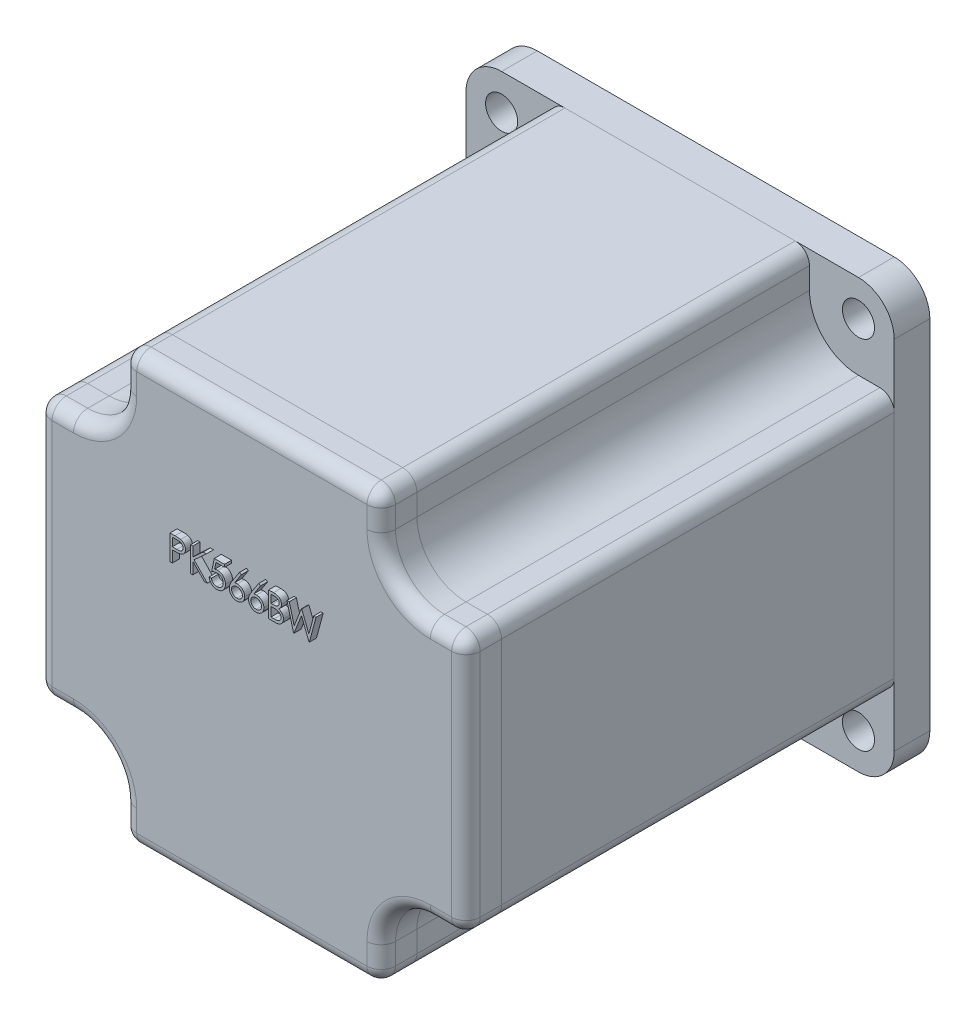
from build123d import *

# Parameters (mm, degrees)
SKETCH1_R           = 2.25
BOSS_EXTRUDE1_DEPTH = 5
BOSS_EXTRUDE2_DEPTH = 60
FILLET1_R           = 2
SKETCH3_R           = 18
BOSS_EXTRUDE3_DEPTH = 1.5
BOSS_EXTRUDE4_DEPTH = 23
BOSS_EXTRUDE5_DEPTH = 1


with BuildPart() as part:
    # Sketch1 → Boss-Extrude1 (new body)
    with BuildSketch(Plane.XY):
        with BuildLine():
            Line((-25, 30), (25, 30))
            ThreePointArc((25, 30), (28.535533906, 28.535533906), (30, 25))
            Line((30, 25), (30, -25))
            ThreePointArc((30, -25), (28.535533906, -28.535533906), (25, -30))
            Line((25, -30), (-25, -30))
            ThreePointArc((-25, -30), (-28.535533906, -28.535533906), (-30, -25))
            Line((-30, -25), (-30, 25))
            ThreePointArc((-30, 25), (-28.535533906, 28.535533906), (-25, 30))
        make_face()
        with Locations((-25, 25)):
            Circle(SKETCH1_R, mode=Mode.SUBTRACT)
        with Locations((25, 25)):
            Circle(SKETCH1_R, mode=Mode.SUBTRACT)
        with Locations((25, -25)):
            Circle(SKETCH1_R, mode=Mode.SUBTRACT)
        with Locations((-25, -25)):
            Circle(SKETCH1_R, mode=Mode.SUBTRACT)
    extrude(amount=-BOSS_EXTRUDE1_DEPTH)

    # Sketch2 → Boss-Extrude2 (add)
    with BuildSketch(Plane.XY):
        with BuildLine():
            Line((-18.130205111, 25), (-18.130205111, 30))
            Line((-18.130205111, 30), (18.130205111, 30))
            Line((18.130205111, 30), (18.130205111, 25))
            ThreePointArc((18.130205111, 25), (20.142321448, 20.142321448), (25, 18.130205111))
            Line((25, 18.130205111), (30, 18.130205111))
            Line((30, 18.130205111), (30, -18.130205111))
            Line((30, -18.130205111), (25, -18.130205111))
            ThreePointArc((25, -18.130205111), (20.142321448, -20.142321448), (18.130205111, -25))
            Line((18.130205111, -25), (18.130205111, -30))
            Line((18.130205111, -30), (-18.130205111, -30))
            Line((-18.130205111, -30), (-18.130205111, -25))
            ThreePointArc((-18.130205111, -25), (-20.142321448, -20.142321448), (-25, -18.130205111))
            Line((-25, -18.130205111), (-30, -18.130205111))
            Line((-30, -18.130205111), (-30, 18.130205111))
            Line((-30, 18.130205111), (-25, 18.130205111))
            ThreePointArc((-25, 18.130205111), (-20.142321448, 20.142321448), (-18.130205111, 25))
        make_face()
    extrude(amount=BOSS_EXTRUDE2_DEPTH)

    # Fillet1
    fillet1_edges = [part.edges().sort_by_distance(p)[0] for p in [
        (18.130205111, -27.5, 60),
        (27.5, -18.130205111, 60),
        (27.5, 18.130205111, 60),
        (18.130205111, 27.5, 60),
        (-18.130205111, 27.5, 60),
        (-27.5, 18.130205111, 60),
        (18.130205111, 30, 30),
        (30, 18.130205111, 30),
        (0, -30, 60),
        (20.142321448, -20.142321448, 60),
        (30, 0, 60),
        (20.142321448, 20.142321448, 60),
        (0, 30, 60),
        (-20.142321448, 20.142321448, 60),
        (-30, 0, 60),
        (30, -18.130205111, 30),
        (18.130205111, -30, 30),
        (-18.130205111, -30, 30),
        (-30, -18.130205111, 30),
        (-30, 18.130205111, 30),
        (-18.130205111, 30, 30),
        (-27.5, -18.130205111, 60),
        (-18.130205111, -27.5, 60),
        (-20.142321448, -20.142321448, 60),
    ]]
    fillet(fillet1_edges, radius=FILLET1_R)

    # Sketch3 → Boss-Extrude3 (add)
    with BuildSketch(Plane(origin=(0, 0, -5), x_dir=(-1, 0, 0), z_dir=(0, 0, -1))):
        Circle(SKETCH3_R)
    extrude(amount=BOSS_EXTRUDE3_DEPTH)

    # Sketch4 → Boss-Extrude4 (add)
    with BuildSketch(Plane(origin=(0, 0, -6.5), x_dir=(-1, 0, 0), z_dir=(0, 0, -1))):
        with BuildLine():
            Line((-1.936491673, 3.5), (1.936491673, 3.5))
            ThreePointArc((1.936491673, 3.5), (0, -4), (-1.936491673, 3.5))
        make_face()
    extrude(amount=BOSS_EXTRUDE4_DEPTH)

    # Sketch5 → Boss-Extrude5 (add)
    # profile 1 of 7: a face of its own
    with BuildSketch(Plane.XY.offset(60)):
        with BuildLine():
            Line((-10.46341446, 11.772716187), (-9.777016222, 11.772716187))
            add(Edge.make_bspline(
                [(-9.777016222, 11.772716187), (-9.729805316, 11.772664291), (-9.639347123, 11.772564855), (-9.509632068, 11.769550109), (-9.391822336, 11.765523417), (-9.286171955, 11.759941524), (-9.192355857, 11.753344934), (-9.110798558, 11.744092894), (-9.040859001, 11.734432599), (-8.998952552, 11.724611192), (-8.979840742, 11.720132052)],
                knots=[0, 0, 0, 0, 1.415646017, 2.712440637, 3.8905458, 4.950247383, 5.884950622, 6.709939814, 7.411656543, 8, 8, 8, 8], degree=3))
            add(Edge.make_bspline(
                [(-8.979840742, 11.720132052), (-8.955647208, 11.713510102), (-8.907830231, 11.700422241), (-8.838929188, 11.674208517), (-8.773375342, 11.643126352), (-8.710943784, 11.607702412), (-8.652401701, 11.566416848), (-8.59687566, 11.52094323), (-8.544855679, 11.470231662), (-8.496634287, 11.414850922), (-8.45234949, 11.355730712), (-8.414219807, 11.291988482), (-8.38229258, 11.224697179), (-8.354909309, 11.153903607), (-8.335200854, 11.079013284), (-8.320353954, 11.000546572), (-8.310930327, 10.918511881), (-8.310027765, 10.862452014), (-8.309568306, 10.833914103)],
                knots=[0, 0, 0, 0, 0.999701418, 1.975846123, 2.934577507, 3.890451536, 4.834027766, 5.787354733, 6.749476667, 7.726910423, 8.712836071, 9.690891519, 10.682875813, 11.679750201, 12.712814741, 13.765529915, 14.8625177, 16, 16, 16, 16], degree=3))
            add(Edge.make_bspline(
                [(-8.309568306, 10.833914103), (-8.30998973, 10.805136327), (-8.310814276, 10.748830663), (-8.320710562, 10.666457875), (-8.334040753, 10.587739484), (-8.354537806, 10.512850034), (-8.381383479, 10.442234263), (-8.412875532, 10.374813031), (-8.450859062, 10.31173336), (-8.494503892, 10.252766242), (-8.543055486, 10.19785633), (-8.596308424, 10.147401535), (-8.654047717, 10.101697197), (-8.716089865, 10.060640853), (-8.783039714, 10.025184574), (-8.853881867, 9.993427269), (-8.929232084, 9.966756208), (-8.981374598, 9.952726147), (-9.007885613, 9.945592789)],
                knots=[0, 0, 0, 0, 1.121902311, 2.195077645, 3.232258892, 4.234102512, 5.217864754, 6.176164875, 7.132989551, 8.084763148, 9.034132444, 9.988522005, 10.94243251, 11.903244335, 12.886203696, 13.894208494, 14.929344452, 16, 16, 16, 16], degree=3))
            add(Edge.make_bspline(
                [(-9.007885613, 9.945592789), (-9.029812947, 9.940929808), (-9.077867975, 9.930710614), (-9.157010697, 9.919302157), (-9.249156083, 9.909564557), (-9.354178363, 9.902263419), (-9.471983268, 9.896013051), (-9.602634525, 9.891044957), (-9.746388602, 9.888315103), (-9.846659846, 9.88817431), (-9.899011415, 9.888100802)],
                knots=[0, 0, 0, 0, 0.601384939, 1.31797006, 2.144135048, 3.087295005, 4.142315834, 5.309527816, 6.595305764, 8, 8, 8, 8], degree=3))
            Line((-9.899011415, 9.888100802), (-10.149311895, 9.888100802))
            Line((-10.149311895, 9.888100802), (-10.149311895, 8.272716187))
            Line((-10.149311895, 8.272716187), (-10.46341446, 8.272716187))
            Line((-10.46341446, 8.272716187), (-10.46341446, 11.772716187))
        make_face()
        with BuildLine():
            Line((-10.149311895, 11.413741828), (-10.149311895, 10.247075161))
            Line((-10.149311895, 10.247075161), (-9.536531447, 10.239362821))
            add(Edge.make_bspline(
                [(-9.536531447, 10.239362821), (-9.506611521, 10.239347358), (-9.448851721, 10.239317506), (-9.365415498, 10.243302729), (-9.28800621, 10.247903262), (-9.216861635, 10.254639185), (-9.151949701, 10.264160443), (-9.093162172, 10.273772181), (-9.040954889, 10.287677543), (-8.979855687, 10.306400612), (-8.91177234, 10.338333228), (-8.837704791, 10.384683118), (-8.774934205, 10.443763826), (-8.720615908, 10.510191658), (-8.67751003, 10.584090787), (-8.645954038, 10.663159724), (-8.62741288, 10.746587573), (-8.624926687, 10.803675712), (-8.62367087, 10.83251186)],
                knots=[0, 0, 0, 0, 1.160613943, 2.240541288, 3.23993089, 4.169200891, 5.011653406, 5.7853311, 6.478053781, 7.106038997, 8.262395093, 9.384106736, 10.481365981, 11.59014053, 12.70357646, 13.786202915, 14.881775077, 16, 16, 16, 16], degree=3))
            add(Edge.make_bspline(
                [(-8.62367087, 10.83251186), (-8.624933516, 10.860650373), (-8.627443501, 10.916586255), (-8.646099364, 10.998565016), (-8.677448678, 11.07680072), (-8.720905273, 11.149773806), (-8.773646403, 11.21596261), (-8.834945746, 11.273459737), (-8.904659007, 11.31968144), (-8.969507238, 11.349514721), (-9.027108424, 11.367729997), (-9.077140384, 11.380474837), (-9.133631059, 11.390650443), (-9.196598838, 11.398889946), (-9.265555672, 11.405943407), (-9.341093987, 11.410729385), (-9.42292763, 11.413530841), (-9.479738201, 11.413669796), (-9.509187697, 11.413741828)],
                knots=[0, 0, 0, 0, 1.120700087, 2.227813068, 3.331159281, 4.466773991, 5.599788987, 6.693661531, 7.80175334, 8.91857717, 9.525282508, 10.207424825, 10.974604443, 11.810962634, 12.737642355, 13.736264703, 14.826523623, 16, 16, 16, 16], degree=3))
            Line((-9.509187697, 11.413741828), (-10.149311895, 11.413741828))
        make_face(mode=Mode.SUBTRACT)
    # profile 2 of 7: a face of its own
    with BuildSketch(Plane.XY.offset(60)):
        Polygon((-7.591619588, 11.772716187), (-7.277517024, 11.772716187), (-7.277517024, 10.439883655), (-5.818482569, 11.772716187), (-5.370465742, 11.772716187), (-7.090317504, 10.202203366), (-5.235850357, 8.272716187), (-5.654420069, 8.272716187), (-7.277517024, 9.961718591), (-7.277517024, 8.272716187), (-7.591619588, 8.272716187), align=None)
    # profile 3 of 7: a face of its own
    with BuildSketch(Plane.XY.offset(60)):
        with BuildLine():
            Line((-2.835209331, 11.772716187), (-2.835209331, 11.413741828))
            Line((-2.835209331, 11.413741828), (-4.025714139, 11.413741828))
            Line((-4.025714139, 11.413741828), (-4.214315902, 10.493168911))
            add(Edge.make_bspline(
                [(-4.214315902, 10.493168911), (-4.177260028, 10.503399183), (-4.105470132, 10.523218717), (-3.999510271, 10.545224487), (-3.898918067, 10.558489931), (-3.833642697, 10.560301242), (-3.802056286, 10.561177725)],
                knots=[0, 0, 0, 0, 1.100273476, 2.13160584, 3.095893838, 4, 4, 4, 4], degree=3))
            add(Edge.make_bspline(
                [(-3.802056286, 10.561177725), (-3.762972547, 10.56033179), (-3.686124149, 10.558668469), (-3.573685202, 10.542696619), (-3.466352309, 10.517556705), (-3.364349939, 10.482436183), (-3.267489388, 10.43752645), (-3.176661827, 10.381426509), (-3.090503914, 10.315893178), (-3.01056132, 10.240548166), (-2.938037012, 10.157626549), (-2.874271022, 10.068468678), (-2.820108432, 9.973941016), (-2.776547677, 9.873140407), (-2.741763343, 9.767181254), (-2.718611348, 9.654948671), (-2.703194639, 9.537500551), (-2.701472253, 9.457195981), (-2.700593947, 9.416245834)],
                knots=[0, 0, 0, 0, 1.052922333, 2.070308379, 3.05430497, 4.020497103, 4.973039431, 5.925935799, 6.892292201, 7.88610001, 8.88166317, 9.857072816, 10.836096531, 11.812156883, 12.81219415, 13.836441305, 14.89672472, 16, 16, 16, 16], degree=3))
            add(Edge.make_bspline(
                [(-2.700593947, 9.416245834), (-2.701259022, 9.387723614), (-2.702580185, 9.331064626), (-2.709298772, 9.246920426), (-2.722234488, 9.164557593), (-2.739602212, 9.083965201), (-2.76214463, 9.005295828), (-2.789433684, 8.928324301), (-2.822829712, 8.853529694), (-2.859461087, 8.780204299), (-2.900707565, 8.710005792), (-2.946486072, 8.644356805), (-2.994851564, 8.582272524), (-3.046892949, 8.524418791), (-3.103093944, 8.471175773), (-3.162773911, 8.422227491), (-3.22545663, 8.376746161), (-3.292111872, 8.336577966), (-3.361254355, 8.29961501), (-3.433882573, 8.269291472), (-3.508343273, 8.242180944), (-3.585708149, 8.220571417), (-3.665801961, 8.203638862), (-3.748756737, 8.192138261), (-3.834137407, 8.183761824), (-3.892012419, 8.183237467), (-3.921246992, 8.182972597)],
                knots=[0, 0, 0, 0, 1.056347294, 2.098418968, 3.122841568, 4.141288669, 5.149314143, 6.15115421, 7.162517403, 8.180376062, 9.185164535, 10.17417709, 11.141909838, 12.097768115, 13.052685741, 14.0056014, 14.954263652, 15.917497458, 16.885230207, 17.854509472, 18.828990115, 19.81800267, 20.826176721, 21.857883937, 22.917946725, 24, 24, 24, 24], degree=3))
            add(Edge.make_bspline(
                [(-3.921246992, 8.182972597), (-3.956121172, 8.183663435), (-4.024732003, 8.185022577), (-4.12525257, 8.199241062), (-4.221967176, 8.219604979), (-4.314097277, 8.250241249), (-4.402468541, 8.288628543), (-4.485891258, 8.337144715), (-4.566497034, 8.392123819), (-4.641009071, 8.457004172), (-4.710165185, 8.527919854), (-4.772071694, 8.604877495), (-4.82720527, 8.686606937), (-4.874683017, 8.773505091), (-4.915181039, 8.865343622), (-4.946996027, 8.962466623), (-4.972674382, 9.064366627), (-4.983537802, 9.134520137), (-4.989055485, 9.170152084)],
                knots=[0, 0, 0, 0, 1.0467383, 2.05933395, 3.04377827, 4.011590433, 4.970194871, 5.932262533, 6.905835911, 7.896367577, 8.894135286, 9.877477877, 10.858688626, 11.851381753, 12.8477658, 13.868841284, 14.917554742, 16, 16, 16, 16], degree=3))
            Line((-4.989055485, 9.170152084), (-4.674952921, 9.170152084))
            add(Edge.make_bspline(
                [(-4.674952921, 9.170152084), (-4.667224364, 9.136775632), (-4.652369647, 9.072624237), (-4.619763899, 8.982492896), (-4.579898023, 8.902173672), (-4.532493675, 8.830604089), (-4.475943644, 8.768195091), (-4.411414215, 8.712578029), (-4.339066492, 8.6624029), (-4.258673262, 8.620580133), (-4.173860183, 8.584911379), (-4.085092973, 8.561159685), (-3.994788627, 8.544458792), (-3.933710256, 8.542787031), (-3.903017825, 8.541946956)],
                knots=[0, 0, 0, 0, 1.136247022, 2.183929868, 3.172523383, 4.106158343, 5.02341133, 5.958108904, 6.928429099, 7.938127109, 8.96079061, 9.975095812, 10.982467395, 12, 12, 12, 12], degree=3))
            add(Edge.make_bspline(
                [(-3.903017825, 8.541946956), (-3.873059381, 8.542767734), (-3.814070958, 8.544383852), (-3.727259572, 8.556822864), (-3.643446697, 8.575980436), (-3.563459341, 8.604650291), (-3.485897801, 8.639495009), (-3.412724031, 8.684210085), (-3.341821154, 8.735670103), (-3.27539302, 8.794626733), (-3.214553571, 8.859596428), (-3.16079745, 8.929073821), (-3.116020536, 9.003190668), (-3.078286427, 9.080663821), (-3.049633129, 9.162342378), (-3.029192147, 9.247843553), (-3.017189088, 9.337378533), (-3.015537909, 9.398447843), (-3.014696511, 9.429567148)],
                knots=[0, 0, 0, 0, 1.027316725, 2.022795036, 3.002884548, 3.971462791, 4.93288096, 5.914575861, 6.907176829, 7.935150275, 8.956128384, 9.956726525, 10.942570165, 11.921478529, 12.907843606, 13.90538589, 14.932640048, 16, 16, 16, 16], degree=3))
            add(Edge.make_bspline(
                [(-3.014696511, 9.429567148), (-3.01535499, 9.4576429), (-3.01664387, 9.512597189), (-3.02717444, 9.592996395), (-3.045491413, 9.669069438), (-3.070915293, 9.741183672), (-3.103194801, 9.809407114), (-3.142641113, 9.873810174), (-3.189994511, 9.933544007), (-3.244086399, 9.988636561), (-3.30334444, 10.039481436), (-3.368788183, 10.082825522), (-3.43904811, 10.11928944), (-3.513277709, 10.150757438), (-3.593242608, 10.173358184), (-3.67735924, 10.190326069), (-3.766535948, 10.200141432), (-3.827506636, 10.20150332), (-3.858847152, 10.202203366)],
                knots=[0, 0, 0, 0, 1.045622112, 2.046656509, 3.013763289, 3.955457236, 4.890082067, 5.820317437, 6.762574623, 7.722996705, 8.69280354, 9.665887285, 10.63943826, 11.638615906, 12.663482002, 13.728887084, 14.832589034, 16, 16, 16, 16], degree=3))
            add(Edge.make_bspline(
                [(-3.858847152, 10.202203366), (-3.885976081, 10.201622775), (-3.941990436, 10.200424002), (-4.027913263, 10.191597505), (-4.118204986, 10.17735821), (-4.212519481, 10.157771963), (-4.311139989, 10.132140886), (-4.41385839, 10.101426386), (-4.520890657, 10.064704387), (-4.593008381, 10.036972173), (-4.630081126, 10.022716187)],
                knots=[0, 0, 0, 0, 0.817624296, 1.688186739, 2.600797293, 3.572016777, 4.590301741, 5.671205678, 6.80286297, 8, 8, 8, 8], degree=3))
            Line((-4.630081126, 10.022716187), (-4.271106767, 11.772716187))
            Line((-4.271106767, 11.772716187), (-2.835209331, 11.772716187))
        make_face()
    # profile 4 of 7: a face of its own
    with BuildSketch(Plane.XY.offset(60)):
        with BuildLine():
            Line((-0.726234972, 11.862459777), (-0.484347953, 11.67245577))
            Line((-0.484347953, 11.67245577), (-1.409127601, 10.25829311))
            add(Edge.make_bspline(
                [(-1.409127601, 10.25829311), (-1.347557324, 10.26810697), (-1.227457537, 10.287250015), (-1.105891638, 10.290407961), (-1.046647633, 10.291946956)],
                knots=[0, 0, 0, 0, 1.025318673, 2, 2, 2, 2], degree=3))
            add(Edge.make_bspline(
                [(-1.046647633, 10.291946956), (-1.011075136, 10.290990844), (-0.941051736, 10.289108767), (-0.838244934, 10.274624916), (-0.739455998, 10.251799804), (-0.645094385, 10.218527548), (-0.554821404, 10.176025194), (-0.468119007, 10.125086324), (-0.386616997, 10.063080643), (-0.309265818, 9.993815688), (-0.239038721, 9.917098703), (-0.176862665, 9.835697366), (-0.124635873, 9.749696485), (-0.082261952, 9.659139619), (-0.049357073, 9.56416636), (-0.025369428, 9.46489822), (-0.011189835, 9.361266749), (-0.009264345, 9.290788574), (-0.008286254, 9.254987821)],
                knots=[0, 0, 0, 0, 1.04369286, 2.054478336, 3.041073146, 4.015093852, 4.984733326, 5.965804835, 6.960378782, 7.985147595, 9.009457201, 10.008161701, 10.986880575, 11.956520048, 12.937015923, 13.931873656, 14.949455224, 16, 16, 16, 16], degree=3))
            add(Edge.make_bspline(
                [(-0.008286254, 9.254987821), (-0.009709359, 9.206008117), (-0.012509693, 9.109627651), (-0.040413489, 8.969250945), (-0.083773134, 8.83551843), (-0.145750662, 8.710565258), (-0.222733045, 8.594562689), (-0.316610638, 8.491777223), (-0.424054126, 8.400107186), (-0.545540924, 8.323450567), (-0.676283888, 8.260847516), (-0.813635886, 8.215882274), (-0.956263032, 8.188198804), (-1.05306764, 8.184728201), (-1.102036254, 8.182972597)],
                knots=[0, 0, 0, 0, 1.031375318, 2.029502543, 3.004789286, 3.987476834, 4.960371455, 5.9300674, 6.912260825, 7.929083631, 8.949397511, 9.960523116, 10.96833055, 12, 12, 12, 12], degree=3))
            add(Edge.make_bspline(
                [(-1.102036254, 8.182972597), (-1.149132955, 8.184500803), (-1.242423273, 8.187527911), (-1.379656067, 8.214493849), (-1.511519085, 8.258200951), (-1.637088466, 8.31841523), (-1.753409079, 8.394473113), (-1.857474715, 8.486035392), (-1.94876649, 8.591144857), (-2.02474111, 8.709785204), (-2.084999842, 8.837275162), (-2.130189768, 8.970212318), (-2.156586011, 9.1081123), (-2.160274568, 9.201593439), (-2.162132408, 9.248677725)],
                knots=[0, 0, 0, 0, 1.012016664, 2.004627821, 2.994792927, 3.992885782, 4.990978636, 5.973936114, 6.964471063, 7.975201453, 8.993600317, 9.990122807, 10.98767138, 12, 12, 12, 12], degree=3))
            add(Edge.make_bspline(
                [(-2.162132408, 9.248677725), (-2.160950963, 9.284722308), (-2.158538678, 9.35831846), (-2.141695288, 9.469782488), (-2.114630493, 9.58383357), (-2.084320247, 9.680587764), (-2.052294637, 9.759849286), (-2.025642097, 9.823752776), (-1.992468101, 9.88951385), (-1.95709472, 9.959387486), (-1.916337851, 10.031572918), (-1.872022202, 10.107276588), (-1.822922551, 10.185294515), (-1.788502388, 10.238238711), (-1.770906447, 10.265304328)],
                knots=[0, 0, 0, 0, 1.173818275, 2.396712641, 3.66331629, 4.989737886, 5.693666774, 6.447286557, 7.243889047, 8.091586357, 8.998013824, 9.943181721, 10.948533338, 12, 12, 12, 12], degree=3))
            Line((-1.770906447, 10.265304328), (-0.726234972, 11.862459777))
        make_face()
        with BuildLine():
            add(Edge.make_bspline(
                [(-1.112553081, 9.932972597), (-1.139215326, 9.932194553), (-1.191294436, 9.930674808), (-1.26770185, 9.921849556), (-1.340015102, 9.905230491), (-1.409192235, 9.884064159), (-1.473939938, 9.854961099), (-1.534728778, 9.8196093), (-1.59179383, 9.777988122), (-1.644537382, 9.730687211), (-1.692357045, 9.678899178), (-1.733538176, 9.623429655), (-1.769060576, 9.565615452), (-1.797942395, 9.50497351), (-1.820432471, 9.441527011), (-1.836700722, 9.375567761), (-1.845754473, 9.306653455), (-1.847260704, 9.259920952), (-1.848029844, 9.236057533)],
                knots=[0, 0, 0, 0, 1.129588631, 2.206414736, 3.251139165, 4.268635594, 5.265702196, 6.250456724, 7.242448911, 8.251968645, 9.246821453, 10.222880186, 11.173611482, 12.116736599, 13.062300278, 14.020270554, 14.989073742, 16, 16, 16, 16], degree=3))
            add(Edge.make_bspline(
                [(-1.848029844, 9.236057533), (-1.847403483, 9.212407553), (-1.846175281, 9.166033463), (-1.835022961, 9.097694284), (-1.817987879, 9.031929375), (-1.792647483, 8.969077777), (-1.762420595, 8.908181459), (-1.722515271, 8.851446173), (-1.678298485, 8.795426103), (-1.625444551, 8.744424632), (-1.568721188, 8.696968007), (-1.508119986, 8.655487754), (-1.444960026, 8.62000158), (-1.378388604, 8.592190483), (-1.30935022, 8.569366196), (-1.237269666, 8.553304717), (-1.16209681, 8.544224191), (-1.111174872, 8.542715997), (-1.085209331, 8.541946956)],
                knots=[0, 0, 0, 0, 0.989467248, 1.94019797, 2.891935182, 3.827694429, 4.772920941, 5.730924762, 6.725747692, 7.756678648, 8.79901574, 9.819492441, 10.826891316, 11.826466727, 12.835195252, 13.867842842, 14.912794438, 16, 16, 16, 16], degree=3))
            add(Edge.make_bspline(
                [(-1.085209331, 8.541946956), (-1.059243833, 8.542716057), (-1.008321978, 8.544224369), (-0.933148518, 8.553304038), (-0.861070199, 8.569368686), (-0.792023691, 8.592181456), (-0.72548226, 8.620035066), (-0.662377538, 8.655266986), (-0.602349445, 8.697223103), (-0.545588845, 8.744343532), (-0.492954907, 8.795716384), (-0.447677628, 8.850946106), (-0.408994395, 8.908640001), (-0.377560208, 8.968837891), (-0.352498916, 9.031967379), (-0.335377449, 9.097684103), (-0.32424816, 9.166036129), (-0.323016794, 9.212408453), (-0.322388819, 9.236057533)],
                knots=[0, 0, 0, 0, 1.087397944, 2.132534446, 3.165364764, 4.174271784, 5.174024072, 6.181601208, 7.194203697, 8.236725232, 9.267838612, 10.269026844, 11.221737037, 12.171628256, 13.107553087, 14.05945871, 15.010357665, 16, 16, 16, 16], degree=3))
            add(Edge.make_bspline(
                [(-0.322388819, 9.236057533), (-0.322939112, 9.259952084), (-0.324019158, 9.306849316), (-0.336235106, 9.375536935), (-0.35317748, 9.441862141), (-0.378760511, 9.50540809), (-0.411997056, 9.565924017), (-0.452480463, 9.623715618), (-0.499313033, 9.679225965), (-0.553410573, 9.730788774), (-0.612300807, 9.777935852), (-0.674916392, 9.819555408), (-0.740424366, 9.854680385), (-0.808758308, 9.883987487), (-0.880701191, 9.905136961), (-0.95509153, 9.921790204), (-1.032880773, 9.930652222), (-1.085657381, 9.932189287), (-1.112553081, 9.932972597)],
                knots=[0, 0, 0, 0, 0.978206639, 1.919901502, 2.851605144, 3.780102724, 4.718870031, 5.675451981, 6.667674623, 7.690630536, 8.733308323, 9.756129687, 10.767539656, 11.776269907, 12.797430371, 13.836405707, 14.897401972, 16, 16, 16, 16], degree=3))
        make_face(mode=Mode.SUBTRACT)
    # profile 5 of 7: a face of its own
    with BuildSketch(Plane.XY.offset(60)):
        with BuildLine():
            Line((1.96607272, 11.862459777), (2.207959739, 11.67245577))
            Line((2.207959739, 11.67245577), (1.283180092, 10.25829311))
            add(Edge.make_bspline(
                [(1.283180092, 10.25829311), (1.344750369, 10.26810697), (1.464850155, 10.287250015), (1.586416054, 10.290407961), (1.64566006, 10.291946956)],
                knots=[0, 0, 0, 0, 1.025318673, 2, 2, 2, 2], degree=3))
            add(Edge.make_bspline(
                [(1.64566006, 10.291946956), (1.681232556, 10.290990844), (1.751255956, 10.289108767), (1.854062759, 10.274624916), (1.952851695, 10.251799804), (2.047213307, 10.218527548), (2.137486289, 10.176025194), (2.224188685, 10.125086324), (2.305690695, 10.063080643), (2.383041874, 9.993815688), (2.453268972, 9.917098703), (2.515445027, 9.835697366), (2.567671819, 9.749696485), (2.61004574, 9.659139619), (2.642950619, 9.56416636), (2.666938264, 9.46489822), (2.681117857, 9.361266749), (2.683043348, 9.290788574), (2.684021438, 9.254987821)],
                knots=[0, 0, 0, 0, 1.04369286, 2.054478336, 3.041073146, 4.015093852, 4.984733326, 5.965804835, 6.960378782, 7.985147595, 9.009457201, 10.008161701, 10.986880575, 11.956520048, 12.937015923, 13.931873656, 14.949455224, 16, 16, 16, 16], degree=3))
            add(Edge.make_bspline(
                [(2.684021438, 9.254987821), (2.682598333, 9.206008117), (2.679797999, 9.109627651), (2.651894203, 8.969250945), (2.608534559, 8.83551843), (2.54655703, 8.710565258), (2.469574647, 8.594562689), (2.375697055, 8.491777223), (2.268253566, 8.400107186), (2.146766768, 8.323450567), (2.016023804, 8.260847516), (1.878671806, 8.215882274), (1.73604466, 8.188198804), (1.639240052, 8.184728201), (1.590271438, 8.182972597)],
                knots=[0, 0, 0, 0, 1.031375318, 2.029502543, 3.004789286, 3.987476834, 4.960371455, 5.9300674, 6.912260825, 7.929083631, 8.949397511, 9.960523116, 10.96833055, 12, 12, 12, 12], degree=3))
            add(Edge.make_bspline(
                [(1.590271438, 8.182972597), (1.543174737, 8.184500803), (1.449884419, 8.187527911), (1.312651625, 8.214493849), (1.180788608, 8.258200951), (1.055219227, 8.31841523), (0.938898614, 8.394473113), (0.834832977, 8.486035392), (0.743541203, 8.591144857), (0.667566582, 8.709785204), (0.60730785, 8.837275162), (0.562117925, 8.970212318), (0.535721682, 9.1081123), (0.532033125, 9.201593439), (0.530175284, 9.248677725)],
                knots=[0, 0, 0, 0, 1.012016664, 2.004627821, 2.994792927, 3.992885782, 4.990978636, 5.973936114, 6.964471063, 7.975201453, 8.993600317, 9.990122807, 10.98767138, 12, 12, 12, 12], degree=3))
            add(Edge.make_bspline(
                [(0.530175284, 9.248677725), (0.531356729, 9.284722308), (0.533769014, 9.35831846), (0.550612404, 9.469782488), (0.577677199, 9.58383357), (0.607987445, 9.680587764), (0.640013056, 9.759849286), (0.666665595, 9.823752776), (0.699839591, 9.88951385), (0.735212972, 9.959387486), (0.775969841, 10.031572918), (0.820285491, 10.107276588), (0.869385142, 10.185294515), (0.903805304, 10.238238711), (0.921401246, 10.265304328)],
                knots=[0, 0, 0, 0, 1.173818275, 2.396712641, 3.66331629, 4.989737886, 5.693666774, 6.447286557, 7.243889047, 8.091586357, 8.998013824, 9.943181721, 10.948533338, 12, 12, 12, 12], degree=3))
            Line((0.921401246, 10.265304328), (1.96607272, 11.862459777))
        make_face()
        with BuildLine():
            add(Edge.make_bspline(
                [(1.579754611, 9.932972597), (1.553092366, 9.932194553), (1.501013257, 9.930674808), (1.424605842, 9.921849556), (1.352292591, 9.905230491), (1.283115457, 9.884064159), (1.218367754, 9.854961099), (1.157578914, 9.8196093), (1.100513862, 9.777988122), (1.047770311, 9.730687211), (0.999950647, 9.678899178), (0.958769516, 9.623429655), (0.923247116, 9.565615452), (0.894365297, 9.50497351), (0.871875222, 9.441527011), (0.855606971, 9.375567761), (0.84655322, 9.306653455), (0.845046988, 9.259920952), (0.844277848, 9.236057533)],
                knots=[0, 0, 0, 0, 1.129588631, 2.206414736, 3.251139165, 4.268635594, 5.265702196, 6.250456724, 7.242448911, 8.251968645, 9.246821453, 10.222880186, 11.173611482, 12.116736599, 13.062300278, 14.020270554, 14.989073742, 16, 16, 16, 16], degree=3))
            add(Edge.make_bspline(
                [(0.844277848, 9.236057533), (0.84490421, 9.212407553), (0.846132411, 9.166033463), (0.857284731, 9.097694284), (0.874319813, 9.031929375), (0.899660209, 8.969077777), (0.929887097, 8.908181459), (0.969792422, 8.851446173), (1.014009207, 8.795426103), (1.066863141, 8.744424632), (1.123586504, 8.696968007), (1.184187706, 8.655487754), (1.247347666, 8.62000158), (1.313919088, 8.592190483), (1.382957472, 8.569366196), (1.455038026, 8.553304717), (1.530210882, 8.544224191), (1.58113282, 8.542715997), (1.607098361, 8.541946956)],
                knots=[0, 0, 0, 0, 0.989467248, 1.94019797, 2.891935182, 3.827694429, 4.772920941, 5.730924762, 6.725747692, 7.756678648, 8.79901574, 9.819492441, 10.826891316, 11.826466727, 12.835195252, 13.867842842, 14.912794438, 16, 16, 16, 16], degree=3))
            add(Edge.make_bspline(
                [(1.607098361, 8.541946956), (1.633063859, 8.542716057), (1.683985714, 8.544224369), (1.759159174, 8.553304038), (1.831237493, 8.569368686), (1.900284002, 8.592181456), (1.966825433, 8.620035066), (2.029930154, 8.655266986), (2.089958248, 8.697223103), (2.146718847, 8.744343532), (2.199352786, 8.795716384), (2.244630064, 8.850946106), (2.283313298, 8.908640001), (2.314747485, 8.968837891), (2.339808776, 9.031967379), (2.356930243, 9.097684103), (2.368059532, 9.166036129), (2.369290898, 9.212408453), (2.369918874, 9.236057533)],
                knots=[0, 0, 0, 0, 1.087397944, 2.132534446, 3.165364764, 4.174271784, 5.174024072, 6.181601208, 7.194203697, 8.236725232, 9.267838612, 10.269026844, 11.221737037, 12.171628256, 13.107553087, 14.05945871, 15.010357665, 16, 16, 16, 16], degree=3))
            add(Edge.make_bspline(
                [(2.369918874, 9.236057533), (2.369368581, 9.259952084), (2.368288535, 9.306849316), (2.356072586, 9.375536935), (2.339130212, 9.441862141), (2.313547181, 9.50540809), (2.280310637, 9.565924017), (2.23982723, 9.623715618), (2.192994659, 9.679225965), (2.13889712, 9.730788774), (2.080006886, 9.777935852), (2.0173913, 9.819555408), (1.951883327, 9.854680385), (1.883549384, 9.883987487), (1.811606502, 9.905136961), (1.737216162, 9.921790204), (1.65942692, 9.930652222), (1.606650311, 9.932189287), (1.579754611, 9.932972597)],
                knots=[0, 0, 0, 0, 0.978206639, 1.919901502, 2.851605144, 3.780102724, 4.718870031, 5.675451981, 6.667674623, 7.690630536, 8.733308323, 9.756129687, 10.767539656, 11.776269907, 12.797430371, 13.836405707, 14.897401972, 16, 16, 16, 16], degree=3))
        make_face(mode=Mode.SUBTRACT)
    # profile 6 of 7: a face of its own
    with BuildSketch(Plane.XY.offset(60)):
        with BuildLine():
            Line((3.357098361, 11.772716187), (4.039990989, 11.772716187))
            add(Edge.make_bspline(
                [(4.039990989, 11.772716187), (4.073419467, 11.772540436), (4.138212178, 11.772199788), (4.232431619, 11.766916657), (4.32068043, 11.759712987), (4.402984202, 11.748282895), (4.479304905, 11.734491118), (4.549872542, 11.717789301), (4.614462714, 11.697762688), (4.691575451, 11.665916407), (4.779496112, 11.618593238), (4.874694504, 11.548664673), (4.956098744, 11.46313221), (5.026285061, 11.366649555), (5.082086181, 11.260513783), (5.122455478, 11.147254594), (5.148013353, 11.028332852), (5.150641787, 10.946689674), (5.151970156, 10.905428527)],
                knots=[0, 0, 0, 0, 1.001505555, 1.941167018, 2.826882275, 3.653841531, 4.429895133, 5.150066043, 5.825578002, 6.45369114, 7.647487171, 8.808567382, 9.977351308, 11.170798116, 12.373658725, 13.556498008, 14.765093433, 16, 16, 16, 16], degree=3))
            add(Edge.make_bspline(
                [(5.151970156, 10.905428527), (5.150876937, 10.866775971), (5.14872866, 10.790820054), (5.128185901, 10.679725945), (5.096025232, 10.573974726), (5.051319983, 10.47395234), (4.993217987, 10.381918727), (4.924359668, 10.297131461), (4.841282866, 10.223180404), (4.779039626, 10.181837502), (4.74742288, 10.16083718)],
                knots=[0, 0, 0, 0, 1.044552857, 2.05264487, 3.044412934, 4.028983338, 5.005914585, 5.980388656, 6.974128949, 8, 8, 8, 8], degree=3))
            add(Edge.make_bspline(
                [(4.74742288, 10.16083718), (4.787183308, 10.145572181), (4.863254855, 10.116366457), (4.967940868, 10.064730993), (5.058135713, 10.008568883), (5.134532859, 9.947237032), (5.199870513, 9.881128222), (5.256923455, 9.809273107), (5.305604829, 9.73073435), (5.347317753, 9.646330814), (5.379866509, 9.556924346), (5.404242413, 9.46335357), (5.418209862, 9.365954015), (5.420197504, 9.299668635), (5.421200925, 9.26620577)],
                knots=[0, 0, 0, 0, 1.27268992, 2.434971085, 3.483601985, 4.442670788, 5.356604649, 6.2567628, 7.179492994, 8.113709626, 9.066344395, 10.018646069, 10.999752585, 12, 12, 12, 12], degree=3))
            add(Edge.make_bspline(
                [(5.421200925, 9.26620577), (5.420224079, 9.232038898), (5.418302107, 9.16481462), (5.404122135, 9.066059485), (5.380113028, 8.971684539), (5.347041882, 8.881079356), (5.303879567, 8.794419222), (5.251351603, 8.711605958), (5.188720039, 8.633471627), (5.11865717, 8.559148004), (5.039395025, 8.492320216), (4.95387927, 8.43280451), (4.86103295, 8.383858448), (4.762380956, 8.342742426), (4.65681664, 8.311335228), (4.544814033, 8.289362654), (4.426469731, 8.274557617), (4.34525998, 8.273340412), (4.303612784, 8.272716187)],
                knots=[0, 0, 0, 0, 0.978564426, 1.925352924, 2.850884081, 3.763762016, 4.682927383, 5.618979971, 6.567305752, 7.547517671, 8.540179244, 9.531824382, 10.526200242, 11.540722885, 12.589160233, 13.674978461, 14.80764778, 16, 16, 16, 16], degree=3))
            Line((4.303612784, 8.272716187), (3.357098361, 8.272716187))
            Line((3.357098361, 8.272716187), (3.357098361, 11.772716187))
        make_face()
        with BuildLine():
            Line((3.671200925, 11.413741828), (3.671200925, 10.291946956))
            Line((3.671200925, 10.291946956), (3.882238585, 10.291946956))
            add(Edge.make_bspline(
                [(3.882238585, 10.291946956), (3.913087381, 10.292346879), (3.97269354, 10.293119612), (4.059013436, 10.295333129), (4.139138455, 10.301531172), (4.212930288, 10.307727434), (4.280272732, 10.317802022), (4.341016593, 10.329794145), (4.39611519, 10.34247705), (4.459654736, 10.364046537), (4.531727684, 10.395924212), (4.608560788, 10.445396048), (4.676295258, 10.504320401), (4.733492446, 10.572311363), (4.780303916, 10.647177549), (4.812817631, 10.727724429), (4.834864915, 10.811944561), (4.836856447, 10.869762814), (4.837867592, 10.89911843)],
                knots=[0, 0, 0, 0, 1.156816544, 2.235205308, 3.236616184, 4.169592532, 5.011045266, 5.787822928, 6.49130361, 7.128639758, 8.301311294, 9.436451833, 10.541879658, 11.654887649, 12.756523258, 13.837046038, 14.901820046, 16, 16, 16, 16], degree=3))
            add(Edge.make_bspline(
                [(4.837867592, 10.89911843), (4.837341412, 10.918544202), (4.836309252, 10.956649974), (4.827855949, 11.012199328), (4.813488375, 11.064443081), (4.795034081, 11.114097191), (4.769245393, 11.159609041), (4.738881929, 11.202552237), (4.702196239, 11.241464355), (4.660438926, 11.277833854), (4.612430304, 11.310078381), (4.558199012, 11.338319145), (4.497011335, 11.361059921), (4.42989848, 11.380976074), (4.355827392, 11.394964368), (4.275652839, 11.406617755), (4.18871812, 11.412550497), (4.128573017, 11.41333586), (4.097482976, 11.413741828)],
                knots=[0, 0, 0, 0, 0.91205012, 1.789085906, 2.630437955, 3.453916878, 4.269457761, 5.079663411, 5.91843418, 6.774407191, 7.675494373, 8.627863946, 9.638891023, 10.736472738, 11.911756761, 13.175263542, 14.539845004, 16, 16, 16, 16], degree=3))
            Line((4.097482976, 11.413741828), (3.671200925, 11.413741828))
        make_face(mode=Mode.SUBTRACT)
        with BuildLine():
            Line((3.671200925, 9.932972597), (3.671200925, 8.631690546))
            Line((3.671200925, 8.631690546), (4.11851663, 8.631690546))
            add(Edge.make_bspline(
                [(4.11851663, 8.631690546), (4.150535556, 8.632074293), (4.212247815, 8.632813916), (4.301349045, 8.63522847), (4.383932149, 8.640720746), (4.459620284, 8.649366596), (4.529230737, 8.658745045), (4.59192844, 8.671356326), (4.648221633, 8.685805286), (4.713495941, 8.708139458), (4.786999449, 8.742835929), (4.866210306, 8.795150156), (4.936636524, 8.857473464), (4.996441783, 8.929604378), (5.045454772, 9.008035705), (5.081110227, 9.091181055), (5.103101084, 9.177666582), (5.105763253, 9.236633295), (5.107098361, 9.26620577)],
                knots=[0, 0, 0, 0, 1.160039823, 2.235823828, 3.228722157, 4.157150951, 4.99529583, 5.772374946, 6.472645482, 7.099169577, 8.269452708, 9.405989375, 10.527446681, 11.663510218, 12.788923519, 13.866172445, 14.929861265, 16, 16, 16, 16], degree=3))
            add(Edge.make_bspline(
                [(5.107098361, 9.26620577), (5.106822257, 9.284699111), (5.106274502, 9.321387492), (5.098013887, 9.375303312), (5.086000017, 9.427529185), (5.070468583, 9.478206925), (5.047849116, 9.526420302), (5.021442571, 9.573122861), (4.990481169, 9.618376341), (4.942237003, 9.675588594), (4.872065019, 9.741505607), (4.772358243, 9.806043109), (4.658985945, 9.858090916), (4.576758452, 9.880190393), (4.534281855, 9.891606411)],
                knots=[0, 0, 0, 0, 0.723448775, 1.435228256, 2.130040452, 2.821711965, 3.505591119, 4.210454504, 4.921174351, 5.648778258, 7.137944449, 8.670945889, 10.280296675, 12, 12, 12, 12], degree=3))
            add(Edge.make_bspline(
                [(4.534281855, 9.891606411), (4.517252759, 9.895061495), (4.480330166, 9.90255283), (4.420122586, 9.910460533), (4.351386717, 9.917505593), (4.27396384, 9.922716751), (4.187755999, 9.928103294), (4.09257908, 9.930198115), (3.988821765, 9.932697375), (3.916829393, 9.93287851), (3.879434098, 9.932972597)],
                knots=[0, 0, 0, 0, 0.634451884, 1.375622551, 2.216452059, 3.157844607, 4.20941857, 5.370758133, 6.634282058, 8, 8, 8, 8], degree=3))
            Line((3.879434098, 9.932972597), (3.671200925, 9.932972597))
        make_face(mode=Mode.SUBTRACT)
    # profile 7 of 7: a face of its own
    with BuildSketch(Plane.XY.offset(60)):
        Polygon((5.914790669, 11.772716187), (6.23941006, 11.772716187), (6.924406053, 9.205909296), (7.943136021, 11.772716187), (7.988708938, 11.772716187), (8.988508617, 9.223437341), (9.67701022, 11.772716187), (9.998124002, 11.772716187), (9.054414066, 8.272716187), (9.009542271, 8.272716187), (7.956457335, 10.9495992), (6.890752207, 8.272716187), (6.845880412, 8.272716187), align=None)
    extrude(amount=BOSS_EXTRUDE5_DEPTH)


solid = part.part
